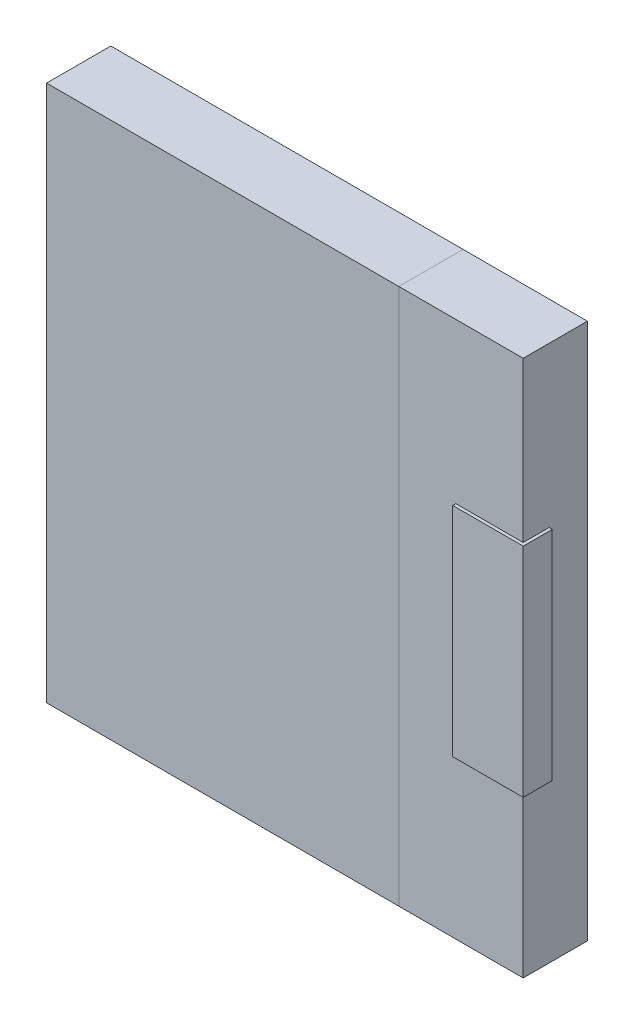
from build123d import *

# Parameters (mm, degrees)
SKETCH1_W              = 460
SKETCH1_H              = 518
BOSS_EXTRUDE1_DEPTH    = 31
SPLIT1_SURFACE_1_BACK  = 696.534
SPLIT1_SURFACE_1_DEPTH = 1393.068
SPLIT1_SURFACE_2_BACK  = 696.534
SPLIT1_SURFACE_2_DEPTH = 1393.068
SKETCH3_W              = 68
SKETCH3_H              = 210
BOSS_EXTRUDE2_DEPTH    = 3
SKETCH4_W              = 3
SKETCH4_H              = 210
BOSS_EXTRUDE3_DEPTH    = 25
SHELL1_T               = -1
SHELL2_T               = -1
SKETCH6_R              = 3.25
CUT_EXTRUDE2_DEPTH     = 5


with BuildPart() as part:
    # Sketch1 → Boss-Extrude1 (new, symmetric)
    with BuildSketch(Plane.XY):
        Rectangle(SKETCH1_W, SKETCH1_H)
    extrude(amount=BOSS_EXTRUDE1_DEPTH, both=True)


with BuildPart() as body_2:
    # Split1: the piece behind the surface
    add(part.part)
    # Split1 surface: a surface, the sketch's curves swept straight by 1393.068 mm
    with BuildLine(Plane.XY.offset(31).offset(-SPLIT1_SURFACE_1_BACK), mode=Mode.PRIVATE) as split1_surface_1_path:
        Line((110, -259), (110, 259))
    split1_surface_1 = Shell.extrude(split1_surface_1_path.wire(), (0 * SPLIT1_SURFACE_1_DEPTH, 0 * SPLIT1_SURFACE_1_DEPTH, 1 * SPLIT1_SURFACE_1_DEPTH))
    split(bisect_by=split1_surface_1, keep=Keep.BOTTOM)

    # Shell2
    shell2_openings = [body_2.faces().sort_by_distance(p)[0] for p in [
        (170, 0, -31),
    ]]
    offset(amount=SHELL2_T, openings=shell2_openings, kind=Kind.INTERSECTION)


with BuildPart() as part_1:
    add(part.part)

    # Split1: split by a surface, the side it looks to stays
    # Split1 surface: a surface, the sketch's curves swept straight by 1393.068 mm
    with BuildLine(Plane.XY.offset(31).offset(-SPLIT1_SURFACE_2_BACK), mode=Mode.PRIVATE) as split1_surface_2_path:
        Line((110, -259), (110, 259))
    split1_surface_2 = Shell.extrude(split1_surface_2_path.wire(), (0 * SPLIT1_SURFACE_2_DEPTH, 0 * SPLIT1_SURFACE_2_DEPTH, 1 * SPLIT1_SURFACE_2_DEPTH))
    split(bisect_by=split1_surface_2, keep=Keep.TOP)

    # Shell1
    shell1_openings = [part_1.faces().sort_by_distance(p)[0] for p in [
        (-60, 0, -31),
    ]]
    offset(amount=SHELL1_T, openings=shell1_openings, kind=Kind.INTERSECTION)

    # Sketch6 → Cut-Extrude2 (cut)
    with BuildSketch(Plane.ZY.offset(230)):
        with Locations(Location((-16, 201.25, 0), (0, 0, 270))):
            Circle(SKETCH6_R)
        with Locations(Location((-16, 181.25, 0), (0, 0, 270))):
            Circle(SKETCH6_R)
        with Locations(Location((-16, 161.25, 0), (0, 0, 270))):
            Circle(SKETCH6_R)
        with Locations(Location((-16, -162.25, 0), (0, 0, 270))):
            Circle(SKETCH6_R)
        with Locations(Location((-16, -182.25, 0), (0, 0, 270))):
            Circle(SKETCH6_R)
        with Locations(Location((-16, -202.25, 0), (0, 0, 270))):
            Circle(SKETCH6_R)
    extrude(amount=-CUT_EXTRUDE2_DEPTH, mode=Mode.SUBTRACT)


with BuildPart() as body_3:
    # Sketch3 → Boss-Extrude2 (new body)
    with BuildSketch(Plane.XY.offset(31)):
        with Locations((199, 0)):
            Rectangle(SKETCH3_W, SKETCH3_H)
    extrude(amount=BOSS_EXTRUDE2_DEPTH)


with BuildPart() as body_4:
    # Sketch4 → Boss-Extrude3 (new body)
    with BuildSketch(Plane(origin=(0, 0, 31), x_dir=(-1, 0, 0), z_dir=(0, 0, -1))):
        with Locations((-231.5, 0)):
            Rectangle(SKETCH4_W, SKETCH4_H)
    extrude(amount=BOSS_EXTRUDE3_DEPTH)


with BuildPart() as body_3_1:
    add(body_3.part)

    # Combine1: union body 4
    add(body_4.part)


solid = Compound([body_2.part, part_1.part, body_3_1.part])
